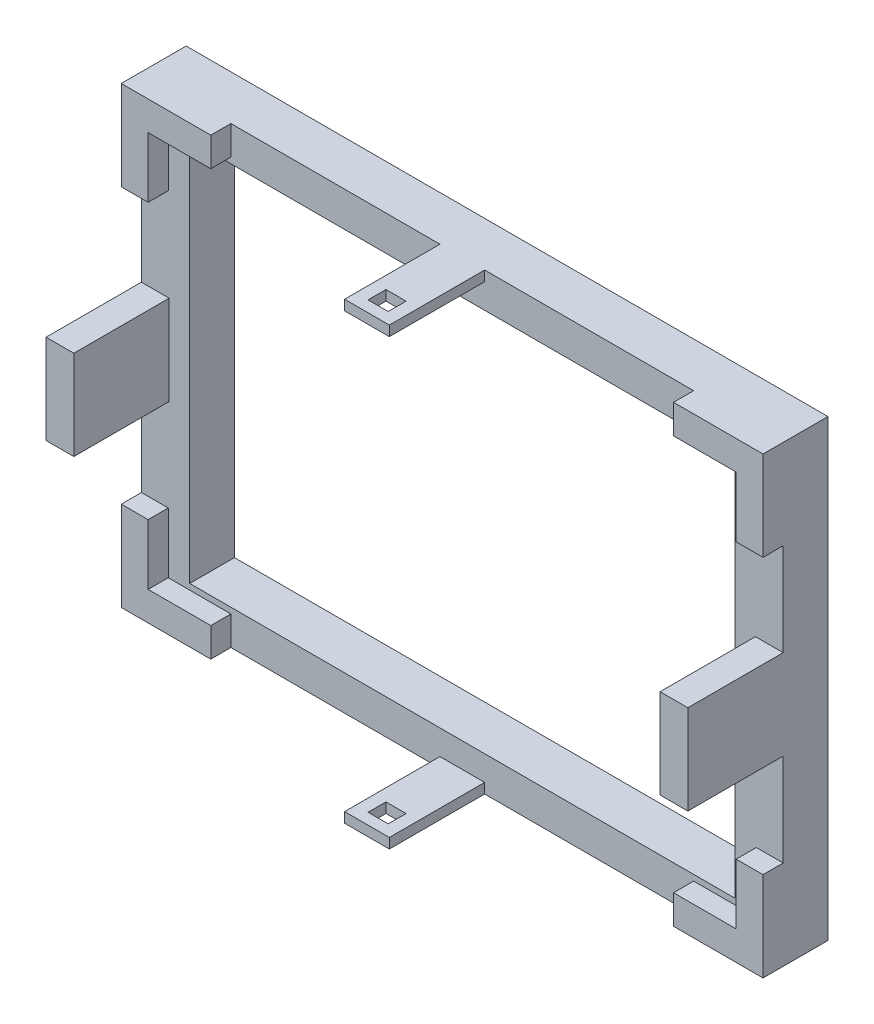
from build123d import *

# Parameters (mm, degrees)
SKETCH2_W                 = 143.4
SKETCH2_H                 = 101.4
BOSS_EXTRUDE2_DEPTH       = 10
SKETCH3_W                 = 121.8
SKETCH3_H                 = 85.8
CUT_EXTRUDE1_DEPTH        = 89.382011744
BOSS_EXTRUDE4_DEPTH       = 4.5
SKETCH8_W                 = 6.2
SKETCH8_H                 = 20
SKETCH8_W_2               = 10
SKETCH8_H_2               = 2.25
BOSS_EXTRUDE5_DEPTH       = 21.3
CUT_EXTRUDE3_REACH        = 130.072
SKETCH10_W                = 4.5
SKETCH10_H                = 4
MIRROR2_COPY_1_DEPTH      = 4.5
MIRROR2_COPY_2_SKETCH_W   = 6.2
MIRROR2_COPY_2_SKETCH_H   = 20
MIRROR2_COPY_2_SKETCH_W_2 = 10
MIRROR2_COPY_2_SKETCH_H_2 = 2.25
MIRROR2_COPY_2_DEPTH      = 21.3
MIRROR2_COPY_3_REACH      = 130.072
MIRROR2_COPY_3_SKETCH_W   = 4.5
MIRROR2_COPY_3_SKETCH_H   = 4
MIRROR2_COPY_4_DEPTH      = 4.5
MIRROR2_COPY_5_REACH      = 130.072
MIRROR2_COPY_5_SKETCH_W   = 4.5
MIRROR2_COPY_5_SKETCH_H   = 4


with BuildPart() as part:
    # Sketch2 → Boss-Extrude2 (new body)
    with BuildSketch(Plane.XY):
        Rectangle(SKETCH2_W, SKETCH2_H)
    extrude(amount=BOSS_EXTRUDE2_DEPTH)

    # Sketch3 → Cut-Extrude1 (cut, through all)
    with BuildSketch(Plane.XY.offset(10)):
        Rectangle(SKETCH3_W, SKETCH3_H)
    extrude(amount=-CUT_EXTRUDE1_DEPTH, mode=Mode.SUBTRACT)

    # Sketch6 → Boss-Extrude4 (add)
    with BuildSketch(Plane.XY.offset(10)):
        Polygon((51.7, 50.7), (51.7, 44.2), (65.7, 44.2), (65.7, 30.7), (71.7, 30.7), (71.7, 50.7), align=None)
    boss_extrude4 = extrude(amount=BOSS_EXTRUDE4_DEPTH)

    # Sketch8 → Boss-Extrude5 (add)
    with BuildSketch(Plane.XY.offset(10)):
        with Locations((68.6, 0)):
            Rectangle(SKETCH8_W, SKETCH8_H)
        with Locations((0, 49.575)):
            Rectangle(SKETCH8_W_2, SKETCH8_H_2)
    boss_extrude5 = extrude(amount=BOSS_EXTRUDE5_DEPTH)

    # Sketch10 → Cut-Extrude3 (cut, up to next)
    with BuildSketch(Plane(origin=(0, 50.7, 0), x_dir=(1, 0, 0), z_dir=(0, 1, 0)), mode=Mode.PRIVATE) as cut_extrude3_sk1:
        with Locations((0, -26.8)):
            Rectangle(SKETCH10_W, SKETCH10_H)
    cut_extrude3_tool1 = extrude(cut_extrude3_sk1.sketch, amount=-CUT_EXTRUDE3_REACH, mode=Mode.PRIVATE) & part.part
    cut_extrude3 = cut_extrude3_tool1.solids().sort_by_distance((0, 50.7, 26.8))[0]
    add(cut_extrude3, mode=Mode.SUBTRACT)

    # Mirror1: Boss-Extrude4, Boss-Extrude5, Cut-Extrude3 across plane
    add(boss_extrude4.mirror(Plane.ZX))
    add(boss_extrude5.mirror(Plane.ZX))
    add(cut_extrude3.mirror(Plane.ZX), mode=Mode.SUBTRACT)

    # Mirror2: Boss-Extrude5 across plane
    add(boss_extrude5.mirror(Plane(origin=(0, 0, 0), x_dir=(0, 0, 1), z_dir=(1, 0, 0))))

    # Mirror2 copy 1 sketch → Mirror2 copy 1 (add)
    with BuildSketch(Plane(origin=(0, 0, 10), x_dir=(-1, 0, 0), z_dir=(0, 0, 1))):
        Polygon((51.7, 50.7), (51.7, 44.2), (65.7, 44.2), (65.7, 30.7), (71.7, 30.7), (71.7, 50.7), align=None)
    extrude(amount=MIRROR2_COPY_1_DEPTH)

    # Mirror2 copy 2 sketch → Mirror2 copy 2 (add)
    with BuildSketch(Plane(origin=(0, 0, 10), x_dir=(-1, 0, 0), z_dir=(0, 0, 1))):
        with Locations((68.6, 0)):
            Rectangle(MIRROR2_COPY_2_SKETCH_W, MIRROR2_COPY_2_SKETCH_H)
        with Locations((0, 49.575)):
            Rectangle(MIRROR2_COPY_2_SKETCH_W_2, MIRROR2_COPY_2_SKETCH_H_2)
    extrude(amount=MIRROR2_COPY_2_DEPTH)

    # Mirror2 copy 3 sketch → Mirror2 copy 3 (cut, up to next)
    with BuildSketch(Plane(origin=(0, -50.7, 0), x_dir=(-1, 0, 0), z_dir=(0, -1, 0)), mode=Mode.PRIVATE) as mirror2_copy_3_sk1:
        with Locations((0, -26.8)):
            Rectangle(MIRROR2_COPY_3_SKETCH_W, MIRROR2_COPY_3_SKETCH_H)
    mirror2_copy_3_tool1 = extrude(mirror2_copy_3_sk1.sketch, amount=-MIRROR2_COPY_3_REACH, mode=Mode.PRIVATE) & part.part
    add(mirror2_copy_3_tool1.solids().sort_by_distance((0, -50.7, 26.8))[0], mode=Mode.SUBTRACT)

    # Mirror2 copy 4 sketch → Mirror2 copy 4 (add)
    with BuildSketch(Plane(origin=(0, 0, 10), x_dir=(-1, 0, 0), z_dir=(0, 0, 1))):
        Polygon((51.7, -50.7), (51.7, -44.2), (65.7, -44.2), (65.7, -30.7), (71.7, -30.7), (71.7, -50.7), align=None)
    extrude(amount=MIRROR2_COPY_4_DEPTH)

    # Mirror2 copy 5 sketch → Mirror2 copy 5 (cut, up to next)
    with BuildSketch(Plane(origin=(0, 50.7, 0), x_dir=(-1, 0, 0), z_dir=(0, 1, 0)), mode=Mode.PRIVATE) as mirror2_copy_5_sk1:
        with Locations((0, 26.8)):
            Rectangle(MIRROR2_COPY_5_SKETCH_W, MIRROR2_COPY_5_SKETCH_H)
    mirror2_copy_5_tool1 = extrude(mirror2_copy_5_sk1.sketch, amount=-MIRROR2_COPY_5_REACH, mode=Mode.PRIVATE) & part.part
    add(mirror2_copy_5_tool1.solids().sort_by_distance((0, 50.7, 26.8))[0], mode=Mode.SUBTRACT)


solid = part.part
